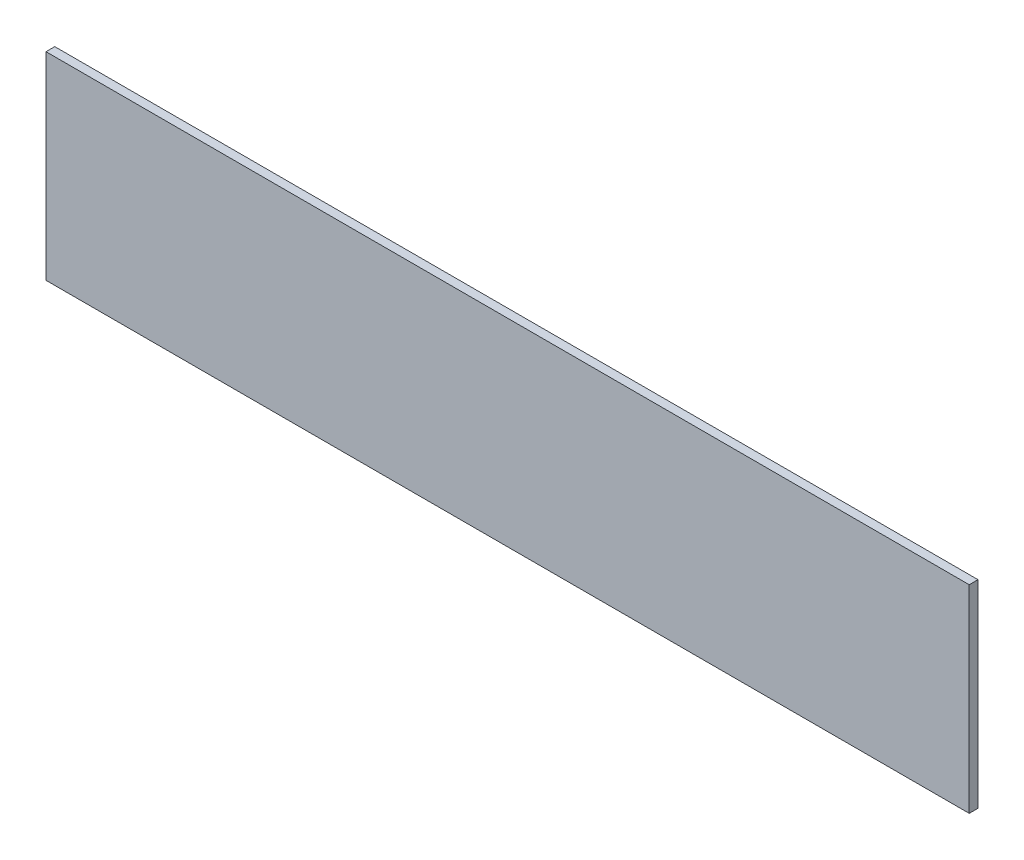
from build123d import *

# Parameters (mm, degrees)
SKETCH1_W           = 200
SKETCH1_H           = 42.9
BOSS_EXTRUDE1_DEPTH = 1.9


with BuildPart() as part:
    # Sketch1 → Boss-Extrude1 (new body)
    with BuildSketch(Plane.XY):
        with Locations((100, 21.45)):
            Rectangle(SKETCH1_W, SKETCH1_H)
    extrude(amount=BOSS_EXTRUDE1_DEPTH)


solid = part.part
